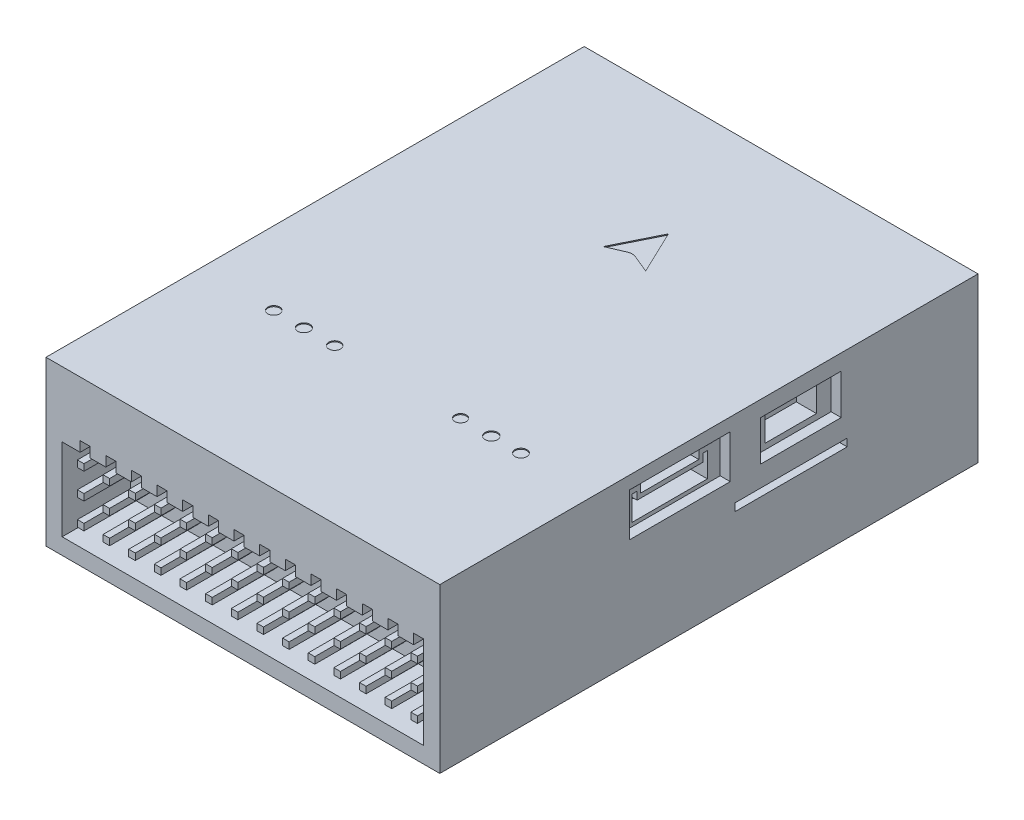
from build123d import *

# Parameters (mm, degrees)
SKETCH1_W           = 39
SKETCH1_H           = 53.3
BOSS_EXTRUDE1_DEPTH = 8.1
CUT_EXTRUDE1_DEPTH  = 6.75
SKETCH3_W           = 0.65
SKETCH3_H           = 0.65
BOSS_EXTRUDE2_DEPTH = 6.29
SKETCH4_W           = 1.033633148
SKETCH4_H           = 0.454798585
SKETCH4_W_2         = 1.054305812
SKETCH4_W_3         = 0.90959717
SKETCH4_H_2         = 0.516816574
SKETCH4_W_4         = 8.083011218
SKETCH4_H_3         = 2.749464174
SKETCH4_W_5         = 4.532673444
SKETCH4_H_4         = 0.950942496
SKETCH4_W_6         = 7.052679944
SKETCH4_H_5         = 1.337958312
CUT_EXTRUDE2_DEPTH  = 3
SKETCH5_W           = 11.242201968
SKETCH5_H           = 4.249021216
SKETCH5_W_2         = 8.697215302
SKETCH5_H_2         = 4.337542492
CUT_EXTRUDE3_DEPTH  = 1
BOSS_EXTRUDE3_DEPTH = 2
SKETCH7_W           = 1.032144434
SKETCH7_H           = 0.468189227
SKETCH7_W_2         = 0.957659784
SKETCH7_W_3         = 5.770064032
SKETCH7_H_2         = 1.287520376
SKETCH7_W_4         = 5.105467607
SKETCH7_H_3         = 2.706139092
SKETCH7_W_5         = 11.106014756
SKETCH7_H_4         = 0.751534833
CUT_EXTRUDE4_DEPTH  = 3
SKETCH8_W           = 9.999660395
SKETCH8_H           = 4.281905861
SKETCH8_W_2         = 7.986908238
SKETCH8_H_2         = 3.987044081
CUT_EXTRUDE5_DEPTH  = 1
SKETCH9_W           = 1.015722023
SKETCH9_H           = 0.423826456
SKETCH9_W_2         = 1.023029376
SKETCH9_W_3         = 1.05956614
SKETCH9_W_4         = 1.051663898
SKETCH9_W_5         = 0.941606048
SKETCH9_W_6         = 0.932033363
SKETCH9_H_2         = 0.434948903
SKETCH9_W_7         = 0.967759083
SKETCH9_W_8         = 0.952745214
SKETCH9_W_9         = 0.99416892
SKETCH9_W_10        = 9.181179644
SKETCH9_H_3         = 1.24607463
SKETCH9_W_11        = 7.026412993
SKETCH9_H_4         = 1.254111374
SKETCH9_W_12        = 4.606204073
SKETCH9_W_13        = 4.591527957
SKETCH9_W_14        = 7.07032551
CUT_EXTRUDE6_DEPTH  = 3
SKETCH10_W          = 8.614197508
SKETCH10_H          = 4.307098754
SKETCH10_W_2        = 8.596325729
SKETCH10_W_3        = 16.084601156
SKETCH10_H_2        = 4.414329429
SKETCH10_W_4        = 11.134118356
SKETCH10_H_3        = 4.414329428
SKETCH10_W_5        = 10.919657007
SKETCH10_W_6        = 11.080503019
CUT_EXTRUDE7_DEPTH  = 1
SKETCH11_R          = 0.58645234
SKETCH11_R_2        = 0.603208121
SKETCH11_R_3        = 0.569696559
SKETCH11_R_4        = 0.621772699
SKETCH11_R_5        = 0.598066385
CUT_EXTRUDE8_DEPTH  = 0.1


with BuildPart() as part:
    # Sketch1 → Boss-Extrude1 (new, symmetric)
    with BuildSketch(Plane(origin=(0, 0, 0), x_dir=(1, 0, 0), z_dir=(0, 1, 0))):
        Rectangle(SKETCH1_W, SKETCH1_H)
    extrude(amount=BOSS_EXTRUDE1_DEPTH, both=True)

    # Sketch2 → Cut-Extrude1 (cut)
    with BuildSketch(Plane.XY.offset(26.65)):
        Polygon((17.9, -6.5), (17.9, 2.64), (16.9, 2.64), (16.9, 1.64), (15.36, 1.64), (15.36, 2.64), (14.36, 2.64), (14.36, 1.64), (12.82, 1.64), (12.82, 2.64), (11.82, 2.64), (11.82, 1.64), (10.28, 1.64), (10.28, 2.64), (9.28, 2.64), (9.28, 1.64), (7.74, 1.64), (7.74, 2.64), (6.74, 2.64), (6.74, 1.64), (5.2, 1.64), (5.2, 2.64), (4.2, 2.64), (4.2, 1.64), (2.66, 1.64), (2.66, 2.64), (1.66, 2.64), (1.66, 1.64), (0.12, 1.64), (0.12, 2.64), (-0.88, 2.64), (-0.88, 1.64), (-2.42, 1.64), (-2.42, 2.64), (-3.42, 2.64), (-3.42, 1.64), (-4.96, 1.64), (-4.96, 2.64), (-5.96, 2.64), (-5.96, 1.64), (-7.5, 1.64), (-7.5, 2.64), (-8.5, 2.64), (-8.5, 1.64), (-10.04, 1.64), (-10.04, 2.64), (-11.04, 2.64), (-11.04, 1.64), (-12.58, 1.64), (-12.58, 2.64), (-13.58, 2.64), (-13.58, 1.64), (-15.12, 1.64), (-15.12, 2.64), (-16.12, 2.64), (-16.12, 1.64), (-17.9, 1.64), (-17.9, -6.5), align=None)
    extrude(amount=-CUT_EXTRUDE1_DEPTH, mode=Mode.SUBTRACT)

    # Sketch3 → Boss-Extrude2 (add)
    with BuildSketch(Plane.XY.offset(19.9)):
        with Locations((-16.525, 0.065)):
            Rectangle(SKETCH3_W, SKETCH3_H)
        with Locations((-13.985, 0.065)):
            Rectangle(SKETCH3_W, SKETCH3_H)
        with Locations((-11.445, 0.065)):
            Rectangle(SKETCH3_W, SKETCH3_H)
        with Locations((-8.905, 0.065)):
            Rectangle(SKETCH3_W, SKETCH3_H)
        with Locations((-6.365, 0.065)):
            Rectangle(SKETCH3_W, SKETCH3_H)
        with Locations((-3.825, 0.065)):
            Rectangle(SKETCH3_W, SKETCH3_H)
        with Locations((-1.285, 0.065)):
            Rectangle(SKETCH3_W, SKETCH3_H)
        with Locations((1.255, 0.065)):
            Rectangle(SKETCH3_W, SKETCH3_H)
        with Locations((3.795, 0.065)):
            Rectangle(SKETCH3_W, SKETCH3_H)
        with Locations((6.335, 0.065)):
            Rectangle(SKETCH3_W, SKETCH3_H)
        with Locations((8.875, 0.065)):
            Rectangle(SKETCH3_W, SKETCH3_H)
        with Locations((11.415, 0.065)):
            Rectangle(SKETCH3_W, SKETCH3_H)
        with Locations((13.955, 0.065)):
            Rectangle(SKETCH3_W, SKETCH3_H)
        with Locations((16.495, 0.065)):
            Rectangle(SKETCH3_W, SKETCH3_H)
        with Locations((-13.985, -2.495)):
            Rectangle(SKETCH3_W, SKETCH3_H)
        with Locations((-11.445, -2.495)):
            Rectangle(SKETCH3_W, SKETCH3_H)
        with Locations((-8.905, -2.495)):
            Rectangle(SKETCH3_W, SKETCH3_H)
        with Locations((-6.365, -2.495)):
            Rectangle(SKETCH3_W, SKETCH3_H)
        with Locations((-3.825, -2.495)):
            Rectangle(SKETCH3_W, SKETCH3_H)
        with Locations((-1.285, -2.495)):
            Rectangle(SKETCH3_W, SKETCH3_H)
        with Locations((1.255, -2.495)):
            Rectangle(SKETCH3_W, SKETCH3_H)
        with Locations((3.795, -2.495)):
            Rectangle(SKETCH3_W, SKETCH3_H)
        with Locations((6.335, -2.495)):
            Rectangle(SKETCH3_W, SKETCH3_H)
        with Locations((8.875, -2.495)):
            Rectangle(SKETCH3_W, SKETCH3_H)
        with Locations((11.415, -2.495)):
            Rectangle(SKETCH3_W, SKETCH3_H)
        with Locations((13.955, -2.495)):
            Rectangle(SKETCH3_W, SKETCH3_H)
        with Locations((16.495, -2.495)):
            Rectangle(SKETCH3_W, SKETCH3_H)
        with Locations((-13.985, -5.055)):
            Rectangle(SKETCH3_W, SKETCH3_H)
        with Locations((-11.445, -5.055)):
            Rectangle(SKETCH3_W, SKETCH3_H)
        with Locations((-8.905, -5.055)):
            Rectangle(SKETCH3_W, SKETCH3_H)
        with Locations((-6.365, -5.055)):
            Rectangle(SKETCH3_W, SKETCH3_H)
        with Locations((-3.825, -5.055)):
            Rectangle(SKETCH3_W, SKETCH3_H)
        with Locations((-1.285, -5.055)):
            Rectangle(SKETCH3_W, SKETCH3_H)
        with Locations((1.255, -5.055)):
            Rectangle(SKETCH3_W, SKETCH3_H)
        with Locations((3.795, -5.055)):
            Rectangle(SKETCH3_W, SKETCH3_H)
        with Locations((6.335, -5.055)):
            Rectangle(SKETCH3_W, SKETCH3_H)
        with Locations((8.875, -5.055)):
            Rectangle(SKETCH3_W, SKETCH3_H)
        with Locations((11.415, -5.055)):
            Rectangle(SKETCH3_W, SKETCH3_H)
        with Locations((13.955, -5.055)):
            Rectangle(SKETCH3_W, SKETCH3_H)
        with Locations((16.495, -5.055)):
            Rectangle(SKETCH3_W, SKETCH3_H)
        with Locations((-16.525, -2.495)):
            Rectangle(SKETCH3_W, SKETCH3_H)
        with Locations((-16.525, -5.055)):
            Rectangle(SKETCH3_W, SKETCH3_H)
    extrude(amount=BOSS_EXTRUDE2_DEPTH)

    # Sketch4 → Cut-Extrude2 (cut)
    with BuildSketch(Plane.ZY.offset(19.5)):
        with BuildLine():
            Line((-13.427957352, 5.295344077), (-6.916068519, 5.295344077))
            ThreePointArc((-6.916068519, 5.295344077), (-5.572345426, 3.951620984), (-6.916068519, 2.607897892))
            Line((-6.916068519, 2.607897892), (-13.427957352, 2.607897892))
            ThreePointArc((-13.427957352, 2.607897892), (-14.771680444, 3.951620984), (-13.427957352, 5.295344077))
        make_face()
        Polygon((6.665188782, -1.567980027), (7.192504752, -1.567980027), (7.192504752, 0.851812034), (0.870322856, 0.851812034), (0.870322856, -1.567980027), (1.373669329, -1.567980027), (1.373669329, -1.212573891), (6.665188782, -1.212573891), align=None)
        with Locations((-1.603194137, 6.08090527)):
            Rectangle(SKETCH4_W, SKETCH4_H)
        with Locations((7.110333301, 6.08090527)):
            Rectangle(SKETCH4_W_2, SKETCH4_H)
        Polygon((-1.603194137, 5.295344077), (-1.086377563, 5.295344077), (-1.086377563, 4.584548793), (6.665188782, 4.584548793), (6.665188782, 5.295344077), (7.110333301, 5.295344077), (7.110333301, 2.897315173), (-1.603194137, 2.897315173), align=None)
        with Locations((0.918870744, -2.260514236)):
            Rectangle(SKETCH4_W_3, SKETCH4_H_2)
        with Locations((7.110333301, -2.260514236)):
            Rectangle(SKETCH4_W_2, SKETCH4_H_2)
        with Locations((-10.172012935, -0.19324794)):
            Rectangle(SKETCH4_W_4, SKETCH4_H_3)
        with Locations((4.022999187, -2.043451275)):
            Rectangle(SKETCH4_W_5, SKETCH4_H_4)
        with Locations((2.762995937, 5.639325406)):
            Rectangle(SKETCH4_W_6, SKETCH4_H_5)
    extrude(amount=-CUT_EXTRUDE2_DEPTH, mode=Mode.SUBTRACT)

    # Sketch5 → Cut-Extrude3 (cut)
    with BuildSketch(Plane.ZY.offset(19.5)):
        with Locations((2.771610306, 4.599129361)):
            Rectangle(SKETCH5_W, SKETCH5_H)
        with Locations((4.044103639, -0.911320029)):
            Rectangle(SKETCH5_W_2, SKETCH5_H_2)
    extrude(amount=-CUT_EXTRUDE3_DEPTH, mode=Mode.SUBTRACT)

    # Sketch6 → Boss-Extrude3 (add)
    with BuildSketch(Plane.ZY.offset(16.5)):
        with BuildLine():
            Line((-13.14106941, 4.432690794), (-7.142098449, 4.432690794))
            ThreePointArc((-7.142098449, 4.432690794), (-6.661028639, 3.951620984), (-7.142098449, 3.470551174))
            Line((-7.142098449, 3.470551174), (-13.14106941, 3.470551174))
            ThreePointArc((-13.14106941, 3.470551174), (-13.622139221, 3.951620984), (-13.14106941, 4.432690794))
        make_face()
    extrude(amount=BOSS_EXTRUDE3_DEPTH)

    # Sketch7 → Cut-Extrude4 (cut)
    with BuildSketch(Plane(origin=(19.5, 0, 0), x_dir=(0, 0, -1), z_dir=(1, 0, 0))):
        Polygon((0.401521242, 5.344298168), (0.848429141, 5.344298168), (0.848429141, 2.918226715), (-6.626637506, 2.918226715), (-6.626637506, 5.344298168), (-6.110565289, 5.344298168), (-6.110565289, 4.567529676), (0.401521242, 4.567529676), align=None)
        with Locations((-6.626637506, 6.057222674)):
            Rectangle(SKETCH7_W, SKETCH7_H)
        with Locations((0.880351134, 6.057222674)):
            Rectangle(SKETCH7_W_2, SKETCH7_H)
        with Locations((-2.885032016, 5.647557099)):
            Rectangle(SKETCH7_W_3, SKETCH7_H_2)
        with Locations((9.102454923, 4.470058514)):
            Rectangle(SKETCH7_W_4, SKETCH7_H_3)
        with Locations((8.145934067, 0.115919971)):
            Rectangle(SKETCH7_W_5, SKETCH7_H_4)
    extrude(amount=-CUT_EXTRUDE4_DEPTH, mode=Mode.SUBTRACT)

    # Sketch8 → Cut-Extrude5 (cut)
    with BuildSketch(Plane(origin=(19.5, 0, 0), x_dir=(0, 0, -1), z_dir=(1, 0, 0))):
        with Locations((-2.886570813, 4.689600665)):
            Rectangle(SKETCH8_W, SKETCH8_H)
        with Locations((9.106611623, 4.542169775)):
            Rectangle(SKETCH8_W_2, SKETCH8_H_2)
    extrude(amount=-CUT_EXTRUDE5_DEPTH, mode=Mode.SUBTRACT)

    # Sketch9 → Cut-Extrude6 (cut)
    with BuildSketch(Plane(origin=(0, 0, -26.65), x_dir=(-1, 0, 0), z_dir=(0, 0, -1))):
        Polygon((15.576321138, 5.335855631), (16.076142887, 5.335855631), (16.076142887, 2.938922671), (2.358812655, 2.938922671), (2.358812655, 5.335855631), (2.864116293, 5.335855631), (2.864116293, 4.585275207), (15.576321138, 4.585275207), align=None)
        with Locations((-16.065897929, 6.04639053)):
            Rectangle(SKETCH9_W, SKETCH9_H)
        with Locations((-9.858301824, 6.04639053)):
            Rectangle(SKETCH9_W_2, SKETCH9_H)
        with Locations((-6.851326195, 6.04639053)):
            Rectangle(SKETCH9_W_3, SKETCH9_H)
        with Locations((-0.6088203, 6.04639053)):
            Rectangle(SKETCH9_W_4, SKETCH9_H)
        with Locations((2.393313269, 6.04639053)):
            Rectangle(SKETCH9_W_5, SKETCH9_H)
        with Locations((16.113460279, 6.04639053)):
            Rectangle(SKETCH9_W_6, SKETCH9_H)
        with Locations((-16.065897929, -2.270108232)):
            Rectangle(SKETCH9_W, SKETCH9_H_2)
        with Locations((-7.335205737, -2.270108232)):
            Rectangle(SKETCH9_W_7, SKETCH9_H_2)
        with Locations((-4.339494059, -2.270108232)):
            Rectangle(SKETCH9_W_8, SKETCH9_H_2)
        with Locations((4.400907694, -2.270108232)):
            Rectangle(SKETCH9_W_9, SKETCH9_H_2)
        with Locations((7.341990748, -2.270108232)):
            Rectangle(SKETCH9_W_9, SKETCH9_H_2)
        with Locations((16.113460279, -2.270108232)):
            Rectangle(SKETCH9_W_6, SKETCH9_H_2)
        Polygon((-16.065897928, 5.279362003), (-15.558036917, 5.279362003), (-15.558036917, 4.634226104), (-10.369816512, 4.634226104), (-10.369816512, 5.279362003), (-9.858301824, 5.279362003), (-9.858301824, 2.938922671), (-16.065897928, 2.938922671), align=None)
        Polygon((-6.851326195, 5.335855631), (-6.321543125, 5.335855631), (-6.321543125, 4.585275207), (-1.134652249, 4.585275207), (-1.134652249, 5.335855631), (-0.6088203, 5.335855631), (-0.6088203, 2.938922671), (-6.851326195, 2.938922671), align=None)
        Polygon((-16.065897928, 0.890391039), (-7.335205736, 0.890391039), (-7.335205736, -1.585360459), (-7.819085278, -1.585360459), (-7.819085278, -0.80808964), (-15.558036917, -0.80808964), (-15.558036917, -1.585360459), (-16.065897928, -1.585360459), align=None)
        Polygon((-4.339494059, 0.890391039), (4.400907694, 0.890391039), (4.400907694, -1.585360459), (3.903823234, -1.585360459), (3.903823234, -0.80808964), (-3.863121452, -0.80808964), (-3.863121452, -1.585360459), (-4.339494059, -1.585360459), align=None)
        Polygon((7.375542065, -1.585360459), (7.839075208, -1.585360459), (7.839075208, -0.75207484), (15.647443598, -0.75207484), (15.647443598, -1.585360459), (16.076142887, -1.585360459), (16.076142887, 0.890391039), (7.375542065, 0.890391039), align=None)
        with Locations((9.256187088, 5.635266443)):
            Rectangle(SKETCH9_W_10, SKETCH9_H_3)
        with Locations((11.738853013, -1.860526996)):
            Rectangle(SKETCH9_W_11, SKETCH9_H_4)
        with Locations((0.01255044, -1.860526996)):
            Rectangle(SKETCH9_W_11, SKETCH9_H_4)
        with Locations((-3.695834195, 5.635266443)):
            Rectangle(SKETCH9_W_12, SKETCH9_H_3)
        with Locations((-12.957953676, 5.635266443)):
            Rectangle(SKETCH9_W_13, SKETCH9_H_3)
        with Locations((-11.718554899, -1.860526996)):
            Rectangle(SKETCH9_W_14, SKETCH9_H_4)
    extrude(amount=-CUT_EXTRUDE6_DEPTH, mode=Mode.SUBTRACT)

    # Sketch10 → Cut-Extrude7 (cut)
    with BuildSketch(Plane(origin=(0, 0, -26.65), x_dir=(-1, 0, 0), z_dir=(0, 0, -1))):
        with Locations((-13.00004837, 4.667534465)):
            Rectangle(SKETCH10_W, SKETCH10_H)
        with Locations((-3.715659148, 4.667534465)):
            Rectangle(SKETCH10_W_2, SKETCH10_H)
        with Locations((9.3039319, 4.613919127)):
            Rectangle(SKETCH10_W_3, SKETCH10_H_2)
        with Locations((-11.740087946, -0.944204161)):
            Rectangle(SKETCH10_W_4, SKETCH10_H_3)
        with Locations((0.126773352, -0.890588824)):
            Rectangle(SKETCH10_W_5, SKETCH10_H)
        with Locations((11.805980969, -0.890588824)):
            Rectangle(SKETCH10_W_6, SKETCH10_H)
    extrude(amount=-CUT_EXTRUDE7_DEPTH, mode=Mode.SUBTRACT)

    # Sketch11 → Cut-Extrude8 (cut)
    with BuildSketch(Plane(origin=(0, 8.1, 0), x_dir=(1, 0, 0), z_dir=(0, 1, 0))):
        with Locations(Location((-12.239667893, -11.353875439, 0), (0, 0, 270))):
            Circle(SKETCH11_R)
        with Locations(Location((-9.257138851, -11.353875439, 0), (0, 0, 270))):
            Circle(SKETCH11_R_2)
        with Locations(Location((-6.207586684, -11.353875439, 0), (0, 0, 270))):
            Circle(SKETCH11_R)
        with Locations(Location((6.258714484, -11.353875439, 0), (0, 0, 270))):
            Circle(SKETCH11_R_3)
        with Locations(Location((9.308266651, -11.353875439, 0), (0, 0, 270))):
            Circle(SKETCH11_R_4)
        with Locations(Location((12.24052835, -11.353875439, 0), (0, 0, 270))):
            Circle(SKETCH11_R_5)
        with BuildLine():
            Line((0.738709346, 14.754747197), (-1.399659813, 10.43912944))
            Line((-1.399659813, 10.43912944), (0.276661714, 11.157354983))
            ThreePointArc((0.276661714, 11.157354983), (0.664355624, 11.238151843), (1.053011509, 11.162116952))
            Line((1.053011509, 11.162116952), (2.799319626, 10.43912944))
            Line((2.799319626, 10.43912944), (0.738709346, 14.754747197))
        make_face()
    extrude(amount=-CUT_EXTRUDE8_DEPTH, mode=Mode.SUBTRACT)


solid = part.part
